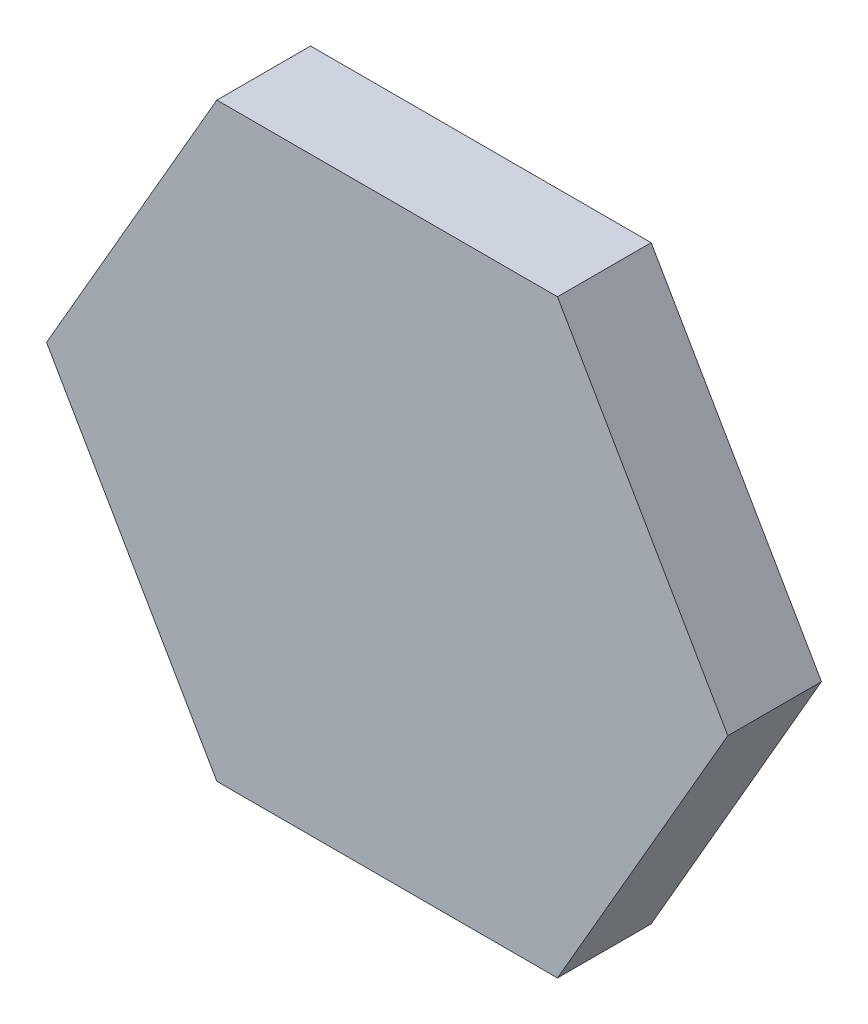
from build123d import *

# Parameters (mm, degrees)
BOSS_EXTRU_1_DEPTH      = 1.5
ESQUISSE3_W             = 15
ESQUISSE3_H             = 60
BOSS_EXTRU_2_DEPTH      = 1.5
ESQUISSE5_W             = 60
ESQUISSE5_H             = 15
BOSS_EXTRU_3_DEPTH      = 1.5
ESQUISSE6_W             = 15
ESQUISSE6_H             = 60
BOSS_EXTRU_4_DEPTH      = 1.5
ENL_V_MAT_EXTRU_1_DEPTH = 1


with BuildPart() as part:
    # Esquisse1 → Boss.-Extru.1 (new body)
    with BuildSketch(Plane.XY):
        Polygon((-30, -51.961524227), (30, -51.961524227), (60, 0), (30, 51.961524227), (-30, 51.961524227), (-60, 0), align=None)
    extrude(amount=BOSS_EXTRU_1_DEPTH)

    # Esquisse3 → Boss.-Extru.2 (add)
    with BuildSketch(Plane(origin=(-45, -25.980762114, 0), x_dir=(0, 0, 1), z_dir=(-0.8660254037844386, -0.5000000000000001, 0))):
        with Locations((-7.5, 0)):
            Rectangle(ESQUISSE3_W, ESQUISSE3_H)
    boss_extru_2 = extrude(amount=-BOSS_EXTRU_2_DEPTH)

    # Esquisse5 → Boss.-Extru.3 (add)
    with BuildSketch(Plane(origin=(0, -51.961524227, 0), x_dir=(-1, 0, 0), z_dir=(0, -1, 0))):
        with Locations((0, 7.5)):
            Rectangle(ESQUISSE5_W, ESQUISSE5_H)
    boss_extru_3 = extrude(amount=-BOSS_EXTRU_3_DEPTH)

    # Esquisse6 → Boss.-Extru.4 (add)
    with BuildSketch(Plane(origin=(45, -25.980762114, 0), x_dir=(0, 0, -1), z_dir=(0.8660254037844389, -0.4999999999999996, 0))):
        with Locations((7.5, 0)):
            Rectangle(ESQUISSE6_W, ESQUISSE6_H)
    boss_extru_4 = extrude(amount=-BOSS_EXTRU_4_DEPTH)

    # Symétrie1: Boss.-Extru.2, Boss.-Extru.3, Boss.-Extru.4 across plane
    add(boss_extru_2.mirror(Plane.ZX))
    add(boss_extru_3.mirror(Plane.ZX))
    add(boss_extru_4.mirror(Plane.ZX))

    # Esquisse7 → Enlèv. mat.-Extru.1 (cut)
    with BuildSketch(Plane(origin=(0, 0, -15), x_dir=(-1, 0, 0), z_dir=(0, 0, -1))):
        Polygon((-59.5, 0), (-29.75, -51.528511525), (29.75, -51.528511525), (59.5, 0), (29.75, 51.528511525), (-29.75, 51.528511525), align=None)
    extrude(amount=-ENL_V_MAT_EXTRU_1_DEPTH, mode=Mode.SUBTRACT)


solid = part.part
